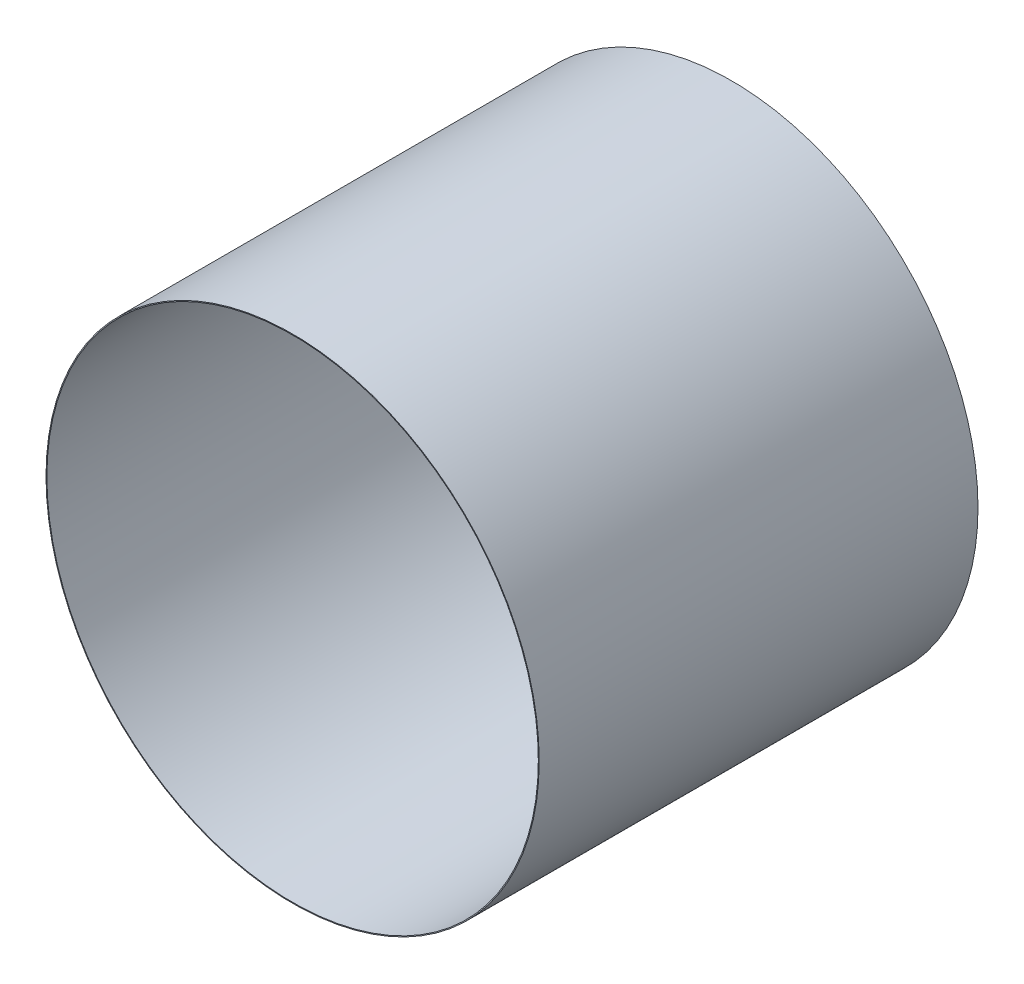
from build123d import *

# Parameters (mm, degrees)
SKETCH1_R           = 14.05
SKETCH1_R_2         = 14
BOSS_EXTRUDE1_DEPTH = 25


with BuildPart() as part:
    # Sketch1 → Boss-Extrude1 (new body)
    with BuildSketch(Plane.XY):
        Circle(SKETCH1_R)
        Circle(SKETCH1_R_2, mode=Mode.SUBTRACT)
    extrude(amount=BOSS_EXTRUDE1_DEPTH)


solid = part.part
